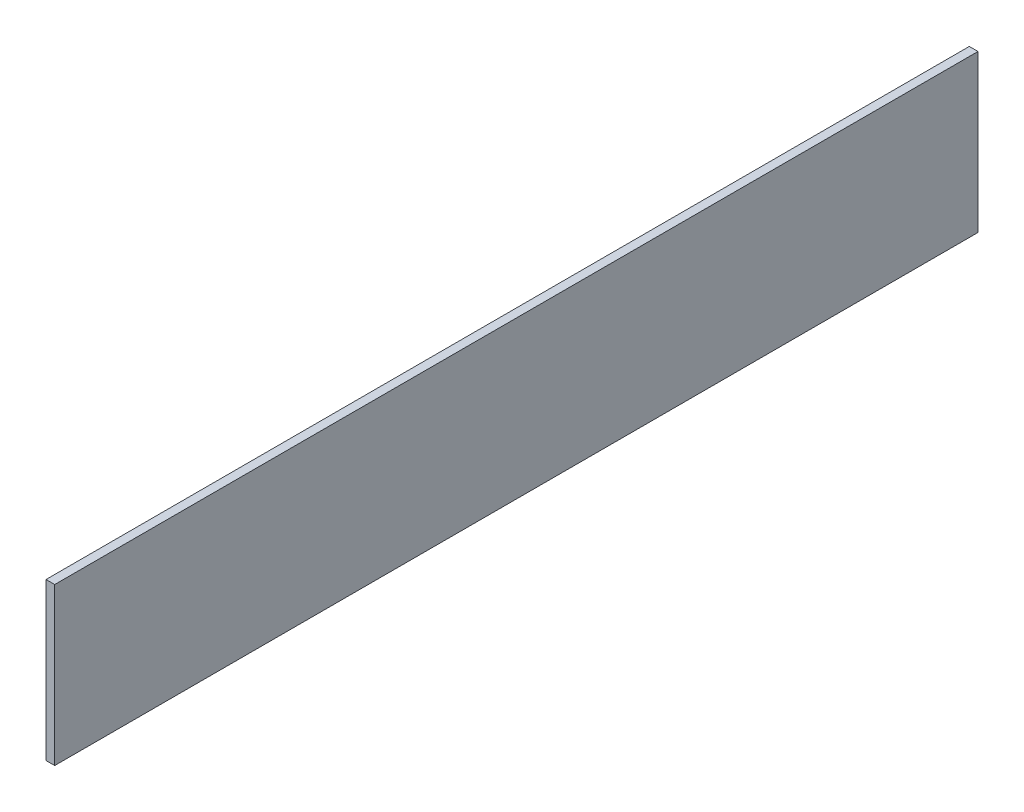
from build123d import *

# Parameters (mm, degrees)
SKETCH1_W           = 168.275
SKETCH1_H           = 28.575
BOSS_EXTRUDE1_DEPTH = 1.5875


with BuildPart() as part:
    # Sketch1 → Boss-Extrude1 (new body)
    with BuildSketch(Plane(origin=(0, 0, 0), x_dir=(0, 0, -1), z_dir=(1, 0, 0))):
        Rectangle(SKETCH1_W, SKETCH1_H)
    extrude(amount=BOSS_EXTRUDE1_DEPTH)


solid = part.part
